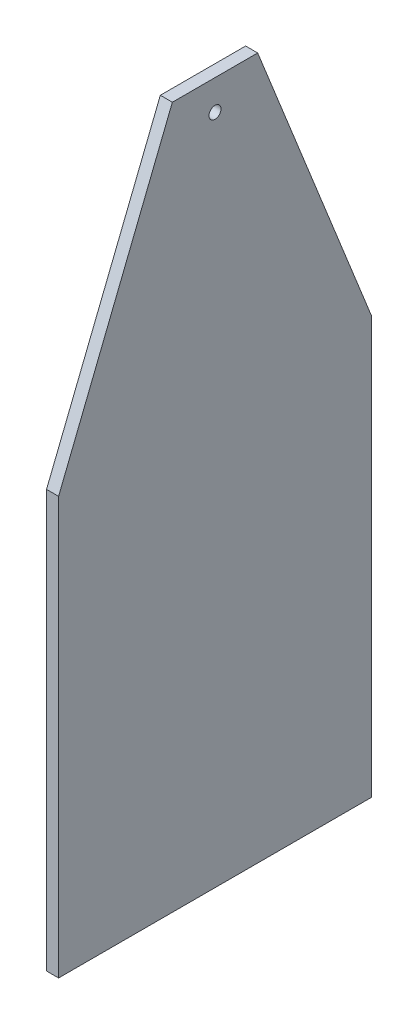
from build123d import *

# Parameters (mm, degrees)
SKETCH1_W                   = 6.35
SKETCH1_H                   = 165
BOSS_EXTRUDE1_DEPTH         = 370
F_1_4_0_25_DIAMETER_HOLE1_D = 6.35
CUT_EXTRUDE1_DEPTH          = 380.139252122


with BuildPart() as part:
    # Sketch1 → Boss-Extrude1 (new body)
    with BuildSketch(Plane(origin=(0, 0, 0), x_dir=(1, 0, 0), z_dir=(0, 1, 0))):
        with Locations((3.175, 0)):
            Rectangle(SKETCH1_W, SKETCH1_H)
    extrude(amount=BOSS_EXTRUDE1_DEPTH)

    # 1/4 (0.25) Diameter Hole1 (through all)
    with Locations(Plane(origin=(6.35, 0, 0), x_dir=(0, 0, -1), z_dir=(1, 0, 0))):
        with Locations((0, 354.147260033)):
            Hole(F_1_4_0_25_DIAMETER_HOLE1_D / 2)

    # Sketch4 → Cut-Extrude1 (cut, through all)
    with BuildSketch(Plane(origin=(6.35, 0, 0), x_dir=(0, 0, -1), z_dir=(1, 0, 0))):
        Polygon((-22.5, 370), (-82.5, 220), (-82.5, 370), align=None)
        Polygon((82.5, 370), (22.5, 370), (82.5, 220), align=None)
    extrude(amount=-CUT_EXTRUDE1_DEPTH, mode=Mode.SUBTRACT)


solid = part.part
